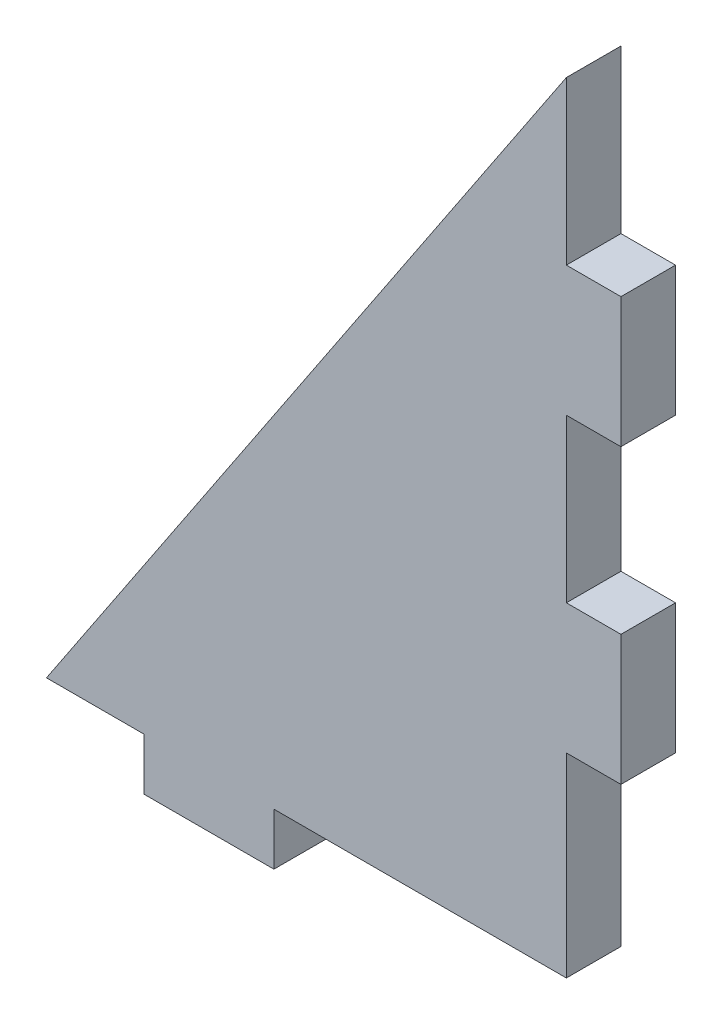
from build123d import *

# Parameters (mm, degrees)
BOSS_EXTRUDE1_DEPTH = 5.334


with BuildPart() as part:
    # Sketch1 → Boss-Extrude1 (new body)
    with BuildSketch(Plane.XY):
        Polygon((0, 0), (0, 19.05), (5.334, 19.05), (5.334, 31.75), (0, 31.75), (0, 47.625), (5.334, 47.625), (5.334, 60.325), (0, 60.325), (0, 76.2), (-50.8, 0), (-41.275, 0), (-41.275, -5.08), (-28.575, -5.08), (-28.575, 0), align=None)
    extrude(amount=BOSS_EXTRUDE1_DEPTH)


solid = part.part
